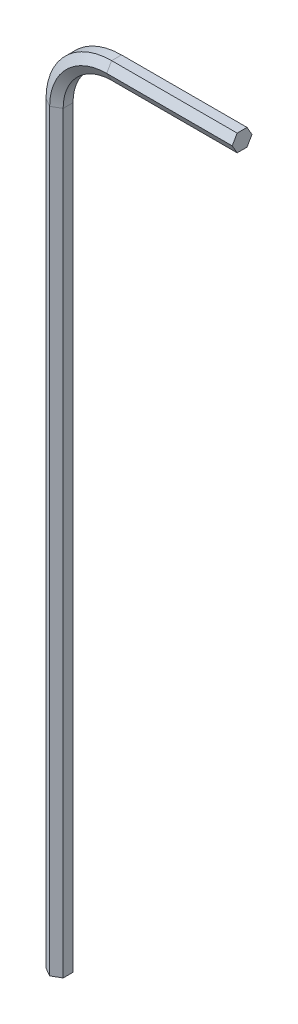
from build123d import *


with BuildPart() as part:
    # Sweep1: sweep along a path in Sketch2
    with BuildLine(Plane.XY) as sweep1_path:
        Line((0, 0), (0, 66))
        ThreePointArc((0, 66), (1.464466094, 69.535533906), (5, 71))
        Line((5, 71), (16, 71))
    # Sketch1 → Sweep1 (sweep)
    with BuildSketch(Plane(origin=(0, 0, 0), x_dir=(1, 0, 0), z_dir=(0, 1, 0))):
        Polygon((0.75, -0.433012702), (0.75, 0.433012702), (0, 0.866025404), (-0.75, 0.433012702), (-0.75, -0.433012702), (0, -0.866025404), align=None)
    sweep(path=sweep1_path.line)


solid = part.part
